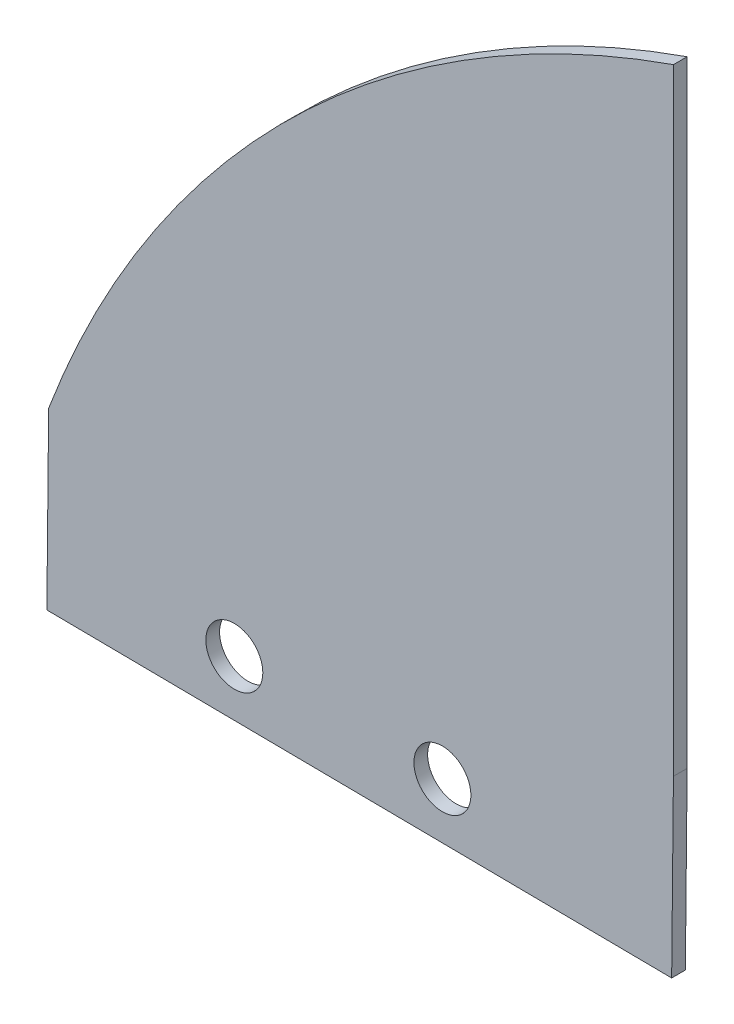
from build123d import *

# Parameters (mm, degrees)
SKETCH1_R           = 3.3
BOSS_EXTRUDE1_DEPTH = 1.5875


with BuildPart() as part:
    # Sketch1 → Boss-Extrude1 (new body)
    with BuildSketch(Plane.XY):
        with BuildLine():
            Line((-68.878774348, 27.170828826), (-69.084500488, 6.833319702))
            Line((-69.084500488, 6.833319702), (3.290042353, 6.101207661))
            Line((3.290042353, 6.101207661), (3.495768493, 26.438716786))
            Line((3.495768493, 26.438716786), (3.495768493, 97.832907794))
            ThreePointArc((3.495768493, 97.832907794), (-40.545204811, 70.545901145), (-68.878774348, 27.170828826))
        make_face()
        with Locations((-47.368063171, 13.042538508)):
            Circle(SKETCH1_R, mode=Mode.SUBTRACT)
        with Locations((-23.266255505, 12.798764706)):
            Circle(SKETCH1_R, mode=Mode.SUBTRACT)
    extrude(amount=BOSS_EXTRUDE1_DEPTH)


solid = part.part
